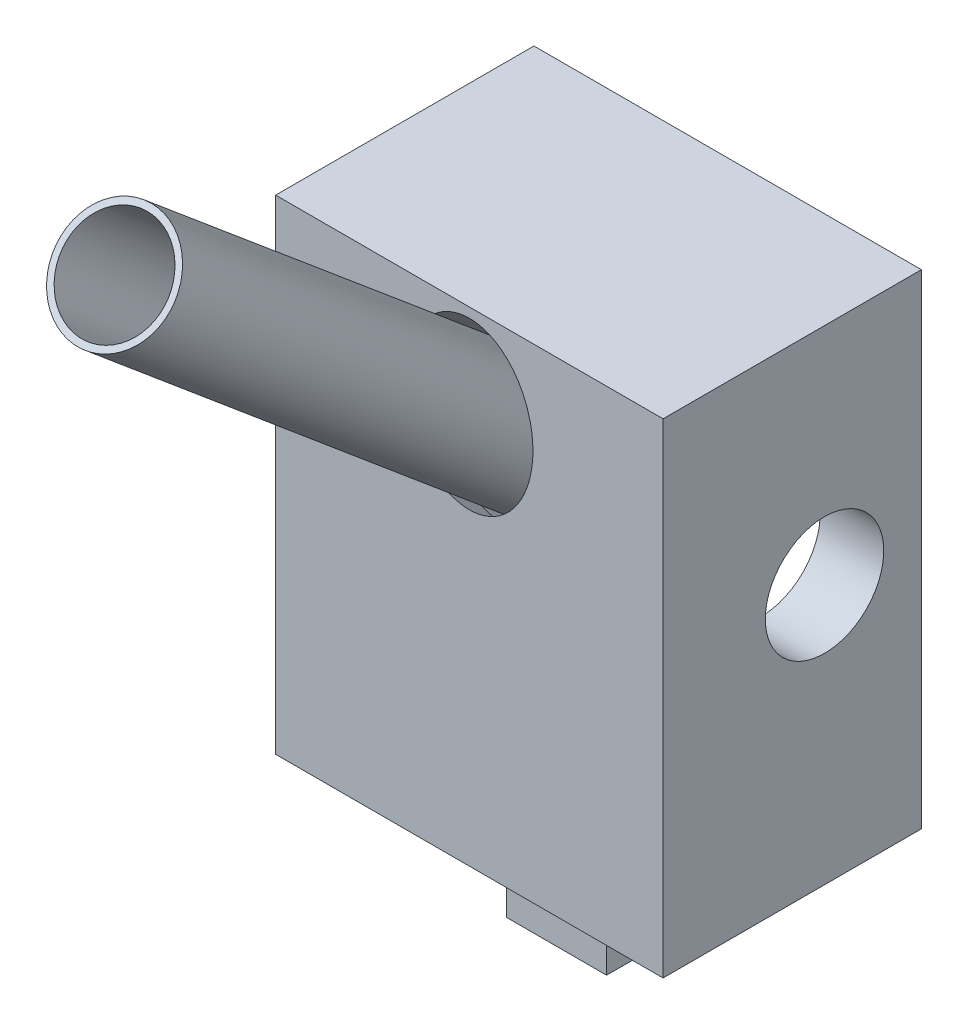
from build123d import *

# Parameters (mm, degrees)
BOSS_EXTRUDE1_START                            = 7.5
SKETCH1_W                                      = 30.48
SKETCH1_H                                      = 38.1
BOSS_EXTRUDE1_DEPTH                            = 20.32
SKETCH2_W                                      = 20.4
SKETCH2_H                                      = 22.86
CUT_EXTRUDE1_DEPTH                             = 17.78
SKETCH5_R                                      = 5
CUT_EXTRUDE2_DEPTH                             = 23
BOSS_EXTRUDE2_DEPTH                            = 21.59
BOSS_EXTRUDE2_DEPTH_BACK                       = 31.75
SKETCH10_R                                     = 4.5
SKETCH11_R                                     = 4
CUT_EXTRUDE6_DEPTH                             = 7540.718926849
CSK_FOR_M3_FLAT_HEAD_MACHINE_SCREW1_AT_2_COUNT = 2
CSK_FOR_M3_FLAT_HEAD_MACHINE_SCREW1_AT_2_PITCH = 22.86
CSK_FOR_M3_FLAT_HEAD_MACHINE_SCREW1_AT_3_COUNT = 2
CSK_FOR_M3_FLAT_HEAD_MACHINE_SCREW1_AT_3_PITCH = 38.1
CSK_FOR_M3_FLAT_HEAD_MACHINE_SCREW1_AT_4_COUNT = 2
CSK_FOR_M3_FLAT_HEAD_MACHINE_SCREW1_AT_4_PITCH = 30.48
SKETCH17_R                                     = 4.659600795
CUT_EXTRUDE7_DEPTH                             = 5742.70602656
SKETCH19_W                                     = 7.874
SKETCH19_H                                     = 6.604
BOSS_EXTRUDE3_DEPTH                            = 8.89


with BuildPart() as part:
    # Sketch1 → Boss-Extrude1 (new body)
    with BuildSketch(Plane.XY.offset(BOSS_EXTRUDE1_START)):
        with Locations((6081.534193548, -5722.275806452)):
            Rectangle(SKETCH1_W, SKETCH1_H)
    extrude(amount=BOSS_EXTRUDE1_DEPTH)

    # Sketch2 → Cut-Extrude1 (cut)
    with BuildSketch(Plane(origin=(0, 0, 7.5), x_dir=(-1, 0, 0), z_dir=(0, 0, -1))):
        with Locations((-6081.574193548, -5722.275806452)):
            Rectangle(SKETCH2_W, SKETCH2_H)
    extrude(amount=-CUT_EXTRUDE1_DEPTH, mode=Mode.SUBTRACT)

    # Sketch5 → Cut-Extrude2 (cut)
    with BuildSketch(Plane(origin=(0, -2342.736843325, -2791.965049535), x_dir=(-1, 0, 0), z_dir=(0, -0.6427876096865405, -0.766044443118977))):
        with Locations(Location((-6081.534193548, -4392.394788186, 0), (0, 0, 163.93758294))):
            Circle(SKETCH5_R)
    extrude(amount=CUT_EXTRUDE2_DEPTH, mode=Mode.SUBTRACT)

    # Sketch14 → CSK for M3 Flat Head Machine Screw1 (revolve, cut)
    with BuildSketch(Plane(origin=(6092.964193548, -5707.035806452, 7.5), x_dir=(0, 1, 0), z_dir=(1, 0, 0))):
        Polygon((0, 0), (0, 9.906), (1.7, 8.884536948), (1.7, 1.45), (3.15, 0), align=None)
    csk_for_m3_flat_head_machine_screw1 = revolve(axis=Axis((6092.964193548, -5707.035806452, 1.15), (0, 0, 1)), mode=Mode.SUBTRACT)

    # CSK for M3 Flat Head Machine Screw1 at 2: CSK for M3 Flat Head Machine Screw1 ×2
    with Locations(*[(-i * CSK_FOR_M3_FLAT_HEAD_MACHINE_SCREW1_AT_2_PITCH, 0, 0) for i in range(1, CSK_FOR_M3_FLAT_HEAD_MACHINE_SCREW1_AT_2_COUNT)]):
        add(csk_for_m3_flat_head_machine_screw1, mode=Mode.SUBTRACT)

    # CSK for M3 Flat Head Machine Screw1 at 3: CSK for M3 Flat Head Machine Screw1 ×2
    with Locations(*[Vector(-0.5999999999999771, -0.8000000000000171, 0) * (i * CSK_FOR_M3_FLAT_HEAD_MACHINE_SCREW1_AT_3_PITCH) for i in range(1, CSK_FOR_M3_FLAT_HEAD_MACHINE_SCREW1_AT_3_COUNT)]):
        add(csk_for_m3_flat_head_machine_screw1, mode=Mode.SUBTRACT)

    # CSK for M3 Flat Head Machine Screw1 at 4: CSK for M3 Flat Head Machine Screw1 ×2
    with Locations(*[(0, -i * CSK_FOR_M3_FLAT_HEAD_MACHINE_SCREW1_AT_4_PITCH, 0) for i in range(1, CSK_FOR_M3_FLAT_HEAD_MACHINE_SCREW1_AT_4_COUNT)]):
        add(csk_for_m3_flat_head_machine_screw1, mode=Mode.SUBTRACT)


with BuildPart() as body_2:
    # Sketch10 → Boss-Extrude2 (new, two sides: drawn at the far end of the back side and taken through both)
    with BuildSketch(Plane(origin=(0, -2342.736843325, -2791.965049535), x_dir=(-1, 0, 0), z_dir=(0, -0.6427876096865405, -0.766044443118977)).offset(-BOSS_EXTRUDE2_DEPTH_BACK)):
        with Locations(Location((-6081.534193548, -4392.394788186, 0), (0, 0, 90))):
            Circle(SKETCH10_R)
    extrude(amount=BOSS_EXTRUDE2_DEPTH + BOSS_EXTRUDE2_DEPTH_BACK)

    # Sketch11 → Cut-Extrude6 (cut, through all)
    with BuildSketch(Plane(origin=(0, -2356.614627818, -2808.503949062), x_dir=(1, 0, 0), z_dir=(0, -0.6427876096865406, -0.766044443118977))):
        with Locations(Location((6081.534193548, 4392.394788186, 0), (0, 0, 270))):
            Circle(SKETCH11_R)
    extrude(amount=-CUT_EXTRUDE6_DEPTH, mode=Mode.SUBTRACT)


with BuildPart() as cut_extrude7_tool:
    # Sketch17 → Cut-Extrude7 (new, through all)
    with BuildSketch(Plane(origin=(6096.774193549, 0, 0), x_dir=(0, 0, -1), z_dir=(1, 0, 0))):
        with Locations(Location((-15.12, -5720.899791669, 0), (0, 0, 90))):
            Circle(SKETCH17_R)
    extrude(amount=-CUT_EXTRUDE7_DEPTH)


with BuildPart() as part_1:
    add(part.part)

    # Cut-Extrude7: cut by cut_extrude7_tool
    add(cut_extrude7_tool.part, mode=Mode.SUBTRACT)

    # Sketch19 → Boss-Extrude3 (add)
    with BuildSketch(Plane.XZ.offset(5741.325806452)):
        with Locations((6081.534193548, 17.66)):
            Rectangle(SKETCH19_W, SKETCH19_H)
    extrude(amount=BOSS_EXTRUDE3_DEPTH)


with BuildPart() as body_2_1:
    add(body_2.part)

    # Cut-Extrude7: cut by cut_extrude7_tool
    add(cut_extrude7_tool.part, mode=Mode.SUBTRACT)


solid = Compound([part_1.part, body_2_1.part])
